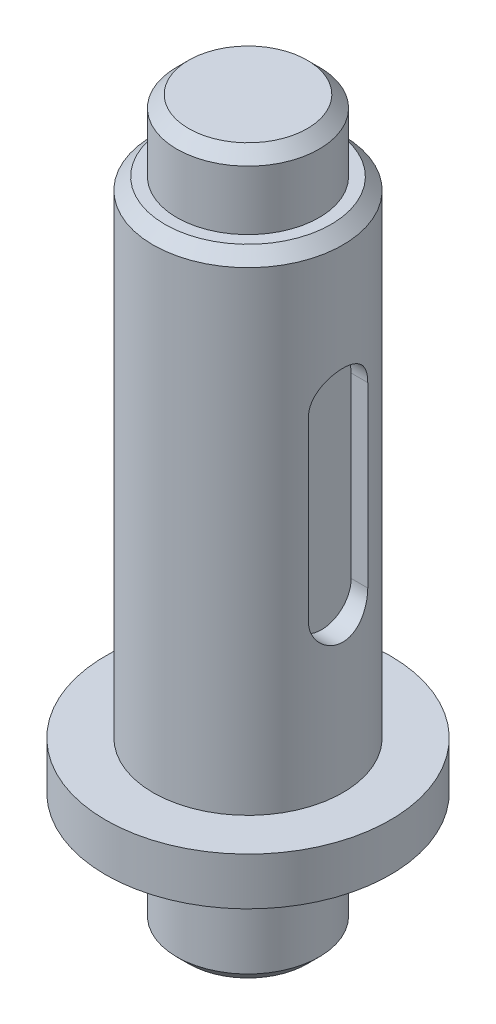
from build123d import *

# Parameters (mm, degrees)
SKETCH1_R           = 6
BOSS_EXTRUDE1_DEPTH = 10
SKETCH2_R           = 12
BOSS_EXTRUDE2_DEPTH = 4
SKETCH3_R           = 8
BOSS_EXTRUDE3_DEPTH = 41
SKETCH4_R           = 6
BOSS_EXTRUDE4_DEPTH = 6
CHAMFER1_SIZE       = 1
CHAMFER2_SIZE       = 1
CHAMFER3_SIZE       = 1
CUT_EXTRUDE1_DEPTH  = 1.8


with BuildPart() as part:
    # Sketch1 → Boss-Extrude1 (new body)
    with BuildSketch(Plane(origin=(0, 0, 0), x_dir=(1, 0, 0), z_dir=(0, 1, 0))):
        with Locations(Location((0, 0, 0), (0, 0, 270))):
            Circle(SKETCH1_R)
    extrude(amount=BOSS_EXTRUDE1_DEPTH)

    # Sketch2 → Boss-Extrude2 (add)
    with BuildSketch(Plane(origin=(0, 10, 0), x_dir=(1, 0, 0), z_dir=(0, 1, 0))):
        with Locations(Location((0, 0, 0), (0, 0, 270))):
            Circle(SKETCH2_R)
    extrude(amount=BOSS_EXTRUDE2_DEPTH)

    # Sketch3 → Boss-Extrude3 (add)
    with BuildSketch(Plane(origin=(0, 14, 0), x_dir=(1, 0, 0), z_dir=(0, 1, 0))):
        with Locations(Location((0, 0, 0), (0, 0, 270))):
            Circle(SKETCH3_R)
    extrude(amount=BOSS_EXTRUDE3_DEPTH)

    # Sketch4 → Boss-Extrude4 (add)
    with BuildSketch(Plane(origin=(0, 55, 0), x_dir=(1, 0, 0), z_dir=(0, 1, 0))):
        with Locations(Location((0, 0, 0), (0, 0, 270))):
            Circle(SKETCH4_R)
    extrude(amount=BOSS_EXTRUDE4_DEPTH)

    # Chamfer1
    chamfer1_edges = [part.edges().sort_by_distance(p)[0] for p in [
        (0, 0, -6),
    ]]
    chamfer(chamfer1_edges, length=CHAMFER1_SIZE)

    # Chamfer2
    chamfer2_edges = [part.edges().sort_by_distance(p)[0] for p in [
        (0, 61, -6),
    ]]
    chamfer(chamfer2_edges, length=CHAMFER2_SIZE)

    # Chamfer3
    chamfer3_edges = [part.edges().sort_by_distance(p)[0] for p in [
        (0, 55, -8),
    ]]
    chamfer(chamfer3_edges, length=CHAMFER3_SIZE)

    # Sketch5 → Cut-Extrude1 (cut)
    with BuildSketch(Plane(origin=(8, 0, 0), x_dir=(0, 0, -1), z_dir=(1, 0, 0))):
        with BuildLine():
            Line((2.5, 42.5), (2.5, 27.5))
            ThreePointArc((2.5, 27.5), (0, 25), (-2.5, 27.5))
            Line((-2.5, 27.5), (-2.5, 42.5))
            ThreePointArc((-2.5, 42.5), (0, 45), (2.5, 42.5))
        make_face()
    extrude(amount=-CUT_EXTRUDE1_DEPTH, mode=Mode.SUBTRACT)


solid = part.part
